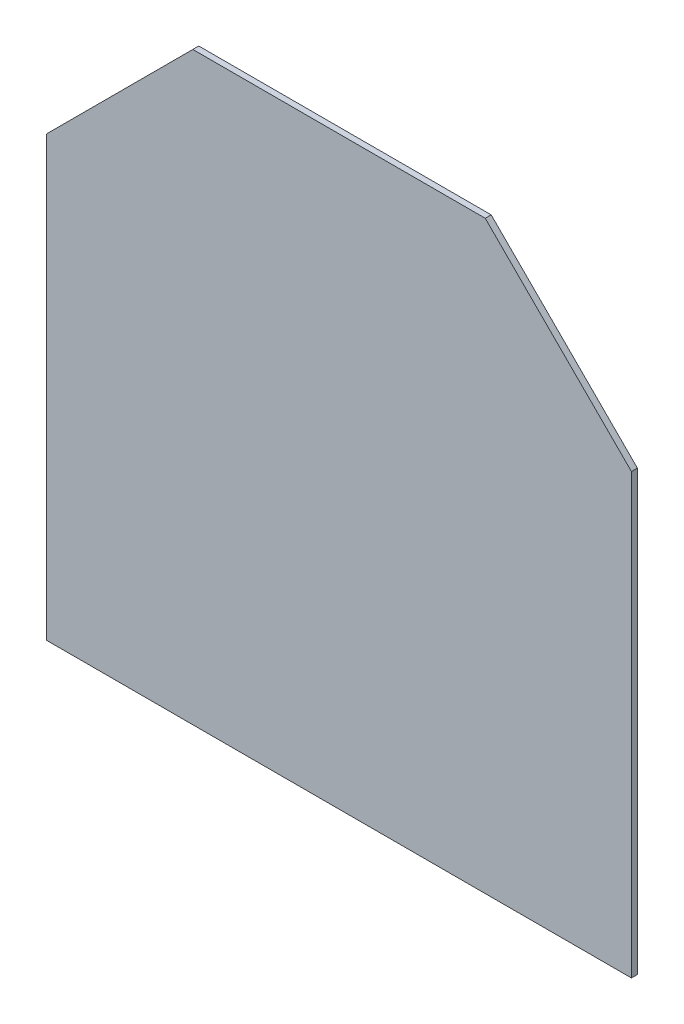
from build123d import *

# Parameters (mm, degrees)
EXTRUDE_GLASS_DEPTH = 0.61


with BuildPart() as part:
    # glass → extrude_glass (new body)
    with BuildSketch(Plane(origin=(0, 0, 1.06), x_dir=(1, 0, 0), z_dir=(0, 0, -1))):
        Polygon((45.00079454, -80), (15.00079454, -80), (0.00079454, -65), (0.00079454, -20), (60.00079454, -20), (60.00079454, -65), align=None)
    extrude(amount=EXTRUDE_GLASS_DEPTH)


solid = part.part
